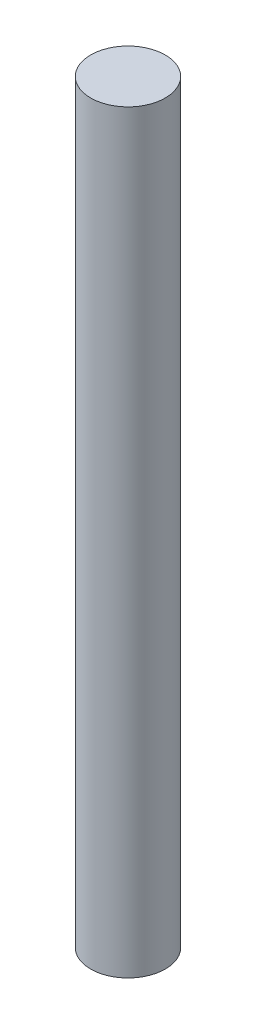
from build123d import *

# Parameters (mm, degrees)
CROQUIS1_R              = 4
SALIENTE_EXTRUIR1_DEPTH = 80.9


with BuildPart() as part:
    # Croquis1 → Saliente-Extruir1 (new body)
    with BuildSketch(Plane(origin=(0, 0, 0), x_dir=(1, 0, 0), z_dir=(0, 1, 0))):
        with Locations(Location((0, 0, 0), (0, 0, 270))):
            Circle(CROQUIS1_R)
    extrude(amount=SALIENTE_EXTRUIR1_DEPTH)


solid = part.part
